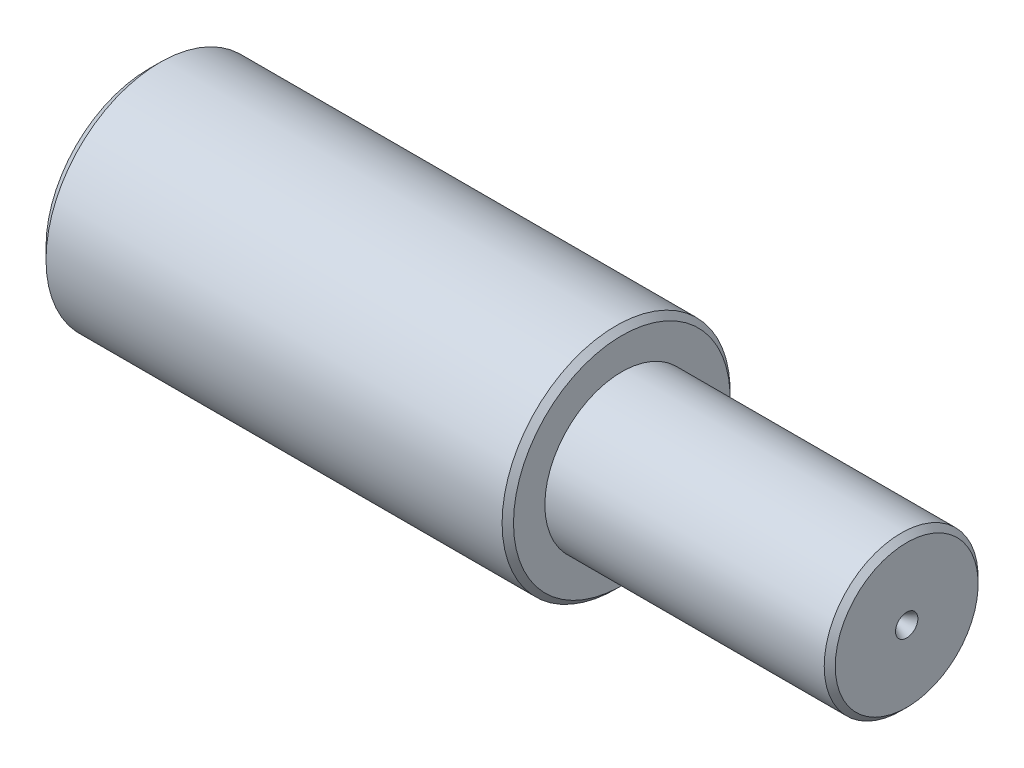
from build123d import *


with BuildPart() as part:
    # Эскиз2 → Повернуть1 (revolve)
    with BuildSketch(Plane(origin=(0, 0, 0), x_dir=(1, 0, 0), z_dir=(0, 1, 0)), mode=Mode.PRIVATE) as revolve_1_sk:
        Polygon((-45.527497303, 22.337527379), (34.472502697, 22.337527379), (35.472502697, 21.337527379), (35.472502697, 15.837527379), (84.472502697, 15.837527379), (85.441558376, 14.8684717), (85.441558376, 4.296423316), (82.259183132, 2.337527379), (-47.527497303, 2.337527379), (-47.527497303, 20.337527379), align=None)
    revolve(revolve_1_sk.sketch.rotate(Axis((-58.608041749, 0, -2.337527379), (1, 0, 0)), 180), axis=Axis((-58.608041749, 0, -2.337527379), (1, 0, 0)))


solid = part.part
